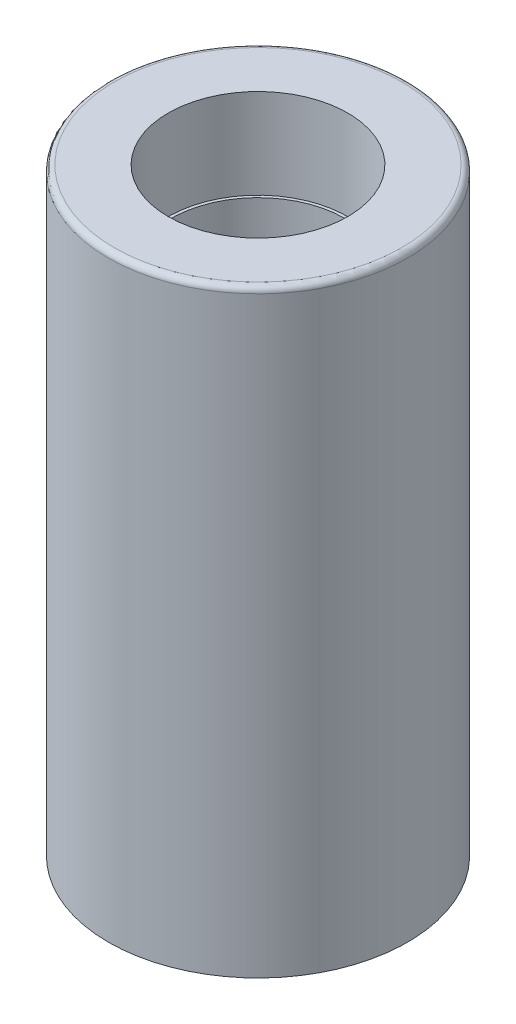
from build123d import *

# Parameters (mm, degrees)
SKIZZE1_R                       = 5
AUFSATZ_LINEAR_AUSTRAGEN1_DEPTH = 20
SKIZZE2_R                       = 2.9
SCHNITT_LINEAR_AUSTRAGEN1_DEPTH = 20
SKIZZE3_R                       = 3
SCHNITT_LINEAR_AUSTRAGEN2_DEPTH = 3
VERRUNDUNG1_R                   = 0.2


with BuildPart() as part:
    # Skizze1 → Aufsatz-Linear austragen1 (new body)
    with BuildSketch(Plane(origin=(0, 0, 0), x_dir=(1, 0, 0), z_dir=(0, 1, 0))):
        with Locations(Location((0, 0, 0), (0, 0, 270))):
            Circle(SKIZZE1_R)
    extrude(amount=AUFSATZ_LINEAR_AUSTRAGEN1_DEPTH)

    # Skizze2 → Schnitt-Linear austragen1 (cut)
    with BuildSketch(Plane(origin=(0, 20, 0), x_dir=(1, 0, 0), z_dir=(0, 1, 0))):
        with Locations(Location((0, 0, 0), (0, 0, 270))):
            Circle(SKIZZE2_R)
    extrude(amount=-SCHNITT_LINEAR_AUSTRAGEN1_DEPTH, mode=Mode.SUBTRACT)

    # Skizze3 → Schnitt-Linear austragen2 (cut)
    with BuildSketch(Plane(origin=(0, 20, 0), x_dir=(1, 0, 0), z_dir=(0, 1, 0))):
        with Locations(Location((0, 0, 0), (0, 0, 270))):
            Circle(SKIZZE3_R)
    extrude(amount=-SCHNITT_LINEAR_AUSTRAGEN2_DEPTH, mode=Mode.SUBTRACT)

    # Verrundung1
    verrundung1_edges = [part.edges().sort_by_distance(p)[0] for p in [
        (0, 20, -5),
    ]]
    fillet(verrundung1_edges, radius=VERRUNDUNG1_R)


solid = part.part
